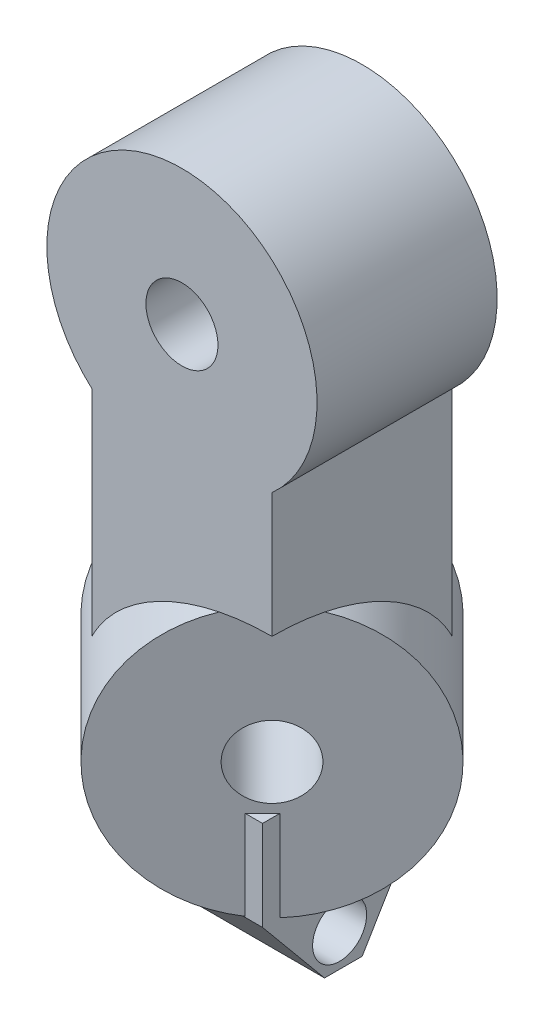
from build123d import *

# Parameters (mm, degrees)
SKETCH1_R               = 1.5
BOSS_EXTRUDE1_DEPTH     = 10
SKETCH2_R               = 2
CUT_EXTRUDE1_DEPTH      = 30
SKETCH6_R               = 7.5
BOSS_EXTRUDE3_DEPTH     = 5
CUT_EXTRUDE4_DEPTH      = 26.013853674
CUT_EXTRUDE4_DEPTH_BACK = 26.013853674
SKETCH7_R               = 1.5
SKETCH8_R               = 2
CUT_EXTRUDE5_DEPTH      = 18
SKETCH10_R              = 7.5
CUT_EXTRUDE7_DEPTH      = 9
SKETCH11_W              = 8
SKETCH11_H              = 8
BOSS_EXTRUDE4_DEPTH     = 5
SKETCH13_R              = 1.5
CUT_EXTRUDE8_DEPTH      = 10


with BuildPart() as part:
    # Sketch1 → Boss-Extrude1 (new body)
    with BuildSketch(Plane.XY):
        with BuildLine():
            Line((5.026455026, -10.023549892), (-4.973544974, -10.023549892))
            Line((-4.973544974, -10.023549892), (-4.973544974, 4.386280164))
            ThreePointArc((-4.973544974, 4.386280164), (0.026455026, 17.476450108), (5.026455026, 4.386280164))
            Line((5.026455026, 4.386280164), (5.026455026, -10.023549892))
        make_face()
        with Locations((0.026455026, 9.976450108)):
            Circle(SKETCH1_R, mode=Mode.SUBTRACT)
    extrude(amount=BOSS_EXTRUDE1_DEPTH)

    # Sketch2 → Cut-Extrude1 (cut)
    with BuildSketch(Plane(origin=(0, 0, 0), x_dir=(-1, 0, 0), z_dir=(0, 0, -1))):
        with Locations((-0.026455026, 9.976450108)):
            Circle(SKETCH2_R)
    extrude(amount=-CUT_EXTRUDE1_DEPTH, mode=Mode.SUBTRACT)

    # Sketch6 → Boss-Extrude3 (add, symmetric)
    with BuildSketch(Plane(origin=(2.513227513, 0, 2.513227513), x_dir=(-0.7071067811865477, 0, 0.7071067811865475), z_dir=(-0.7071067811865475, 0, -0.7071067811865477))):
        with Locations((3.516827377, -10.023549892)):
            Circle(SKETCH6_R)
    extrude(amount=BOSS_EXTRUDE3_DEPTH, both=True)

    # Sketch7 → Cut-Extrude4 (cut, two sides: drawn at the far end of the back side and taken through both)
    with BuildSketch(Plane(origin=(-1.022306393, 0, -1.022306393), x_dir=(-0.7071067811865476, 0, 0.7071067811865476), z_dir=(-0.7071067811865476, 0, -0.7071067811865476)).offset(-CUT_EXTRUDE4_DEPTH_BACK)):
        with Locations((3.516827377, -10.023549892)):
            Circle(SKETCH7_R)
    extrude(amount=CUT_EXTRUDE4_DEPTH + CUT_EXTRUDE4_DEPTH_BACK, mode=Mode.SUBTRACT)

    # Sketch8 → Cut-Extrude5 (cut, symmetric)
    with BuildSketch(Plane(origin=(-1.022306393, 0, -1.022306393), x_dir=(-0.7071067811865476, 0, 0.7071067811865476), z_dir=(-0.7071067811865476, 0, -0.7071067811865476))):
        with Locations((3.516827377, -10.023549892)):
            Circle(SKETCH8_R)
    extrude(amount=CUT_EXTRUDE5_DEPTH, both=True, mode=Mode.SUBTRACT)

    # Sketch10 → Cut-Extrude7 (cut)
    with BuildSketch(Plane(origin=(6.048761419, 0, 6.048761419), x_dir=(0.7071067811865476, 0, -0.7071067811865476), z_dir=(0.7071067811865476, 0, 0.7071067811865476))):
        with Locations((-3.516827377, -10.023549892)):
            Circle(SKETCH10_R)
    cut_extrude7 = extrude(amount=CUT_EXTRUDE7_DEPTH, mode=Mode.SUBTRACT)

    # Mirror1: Cut-Extrude7 across plane
    add(cut_extrude7.mirror(Plane(origin=(2.513227513, 0, 2.513227513), x_dir=(-0.7071067811865478, 0, 0.7071067811865472), z_dir=(-0.7071067811865475, 0, -0.7071067811865477))), mode=Mode.SUBTRACT)

    # Sketch11 → Boss-Extrude4 (add, symmetric)
    with BuildSketch(Plane(origin=(0, -17.5, 0), x_dir=(1, 0, 0), z_dir=(0, 1, 0))):
        with Locations((-0.219742317, -5.27916127)):
            Rectangle(SKETCH11_W, SKETCH11_H)
    extrude(amount=BOSS_EXTRUDE4_DEPTH, both=True)

    # Sketch13 → Cut-Extrude8 (cut)
    with BuildSketch(Plane(origin=(3.780257683, 0, 0), x_dir=(0, 0, -1), z_dir=(1, 0, 0))):
        with Locations((-5, -19.771629817)):
            Circle(SKETCH13_R)
        Polygon((-5.836861044, -21.653637688), (-9.27916127, -17.5), (-9.27916127, -22.5), (-1.27916127, -22.5), (-1.27916127, -17.51897011), (-3.745741187, -21.653637688), align=None)
    extrude(amount=-CUT_EXTRUDE8_DEPTH, mode=Mode.SUBTRACT)


solid = part.part
